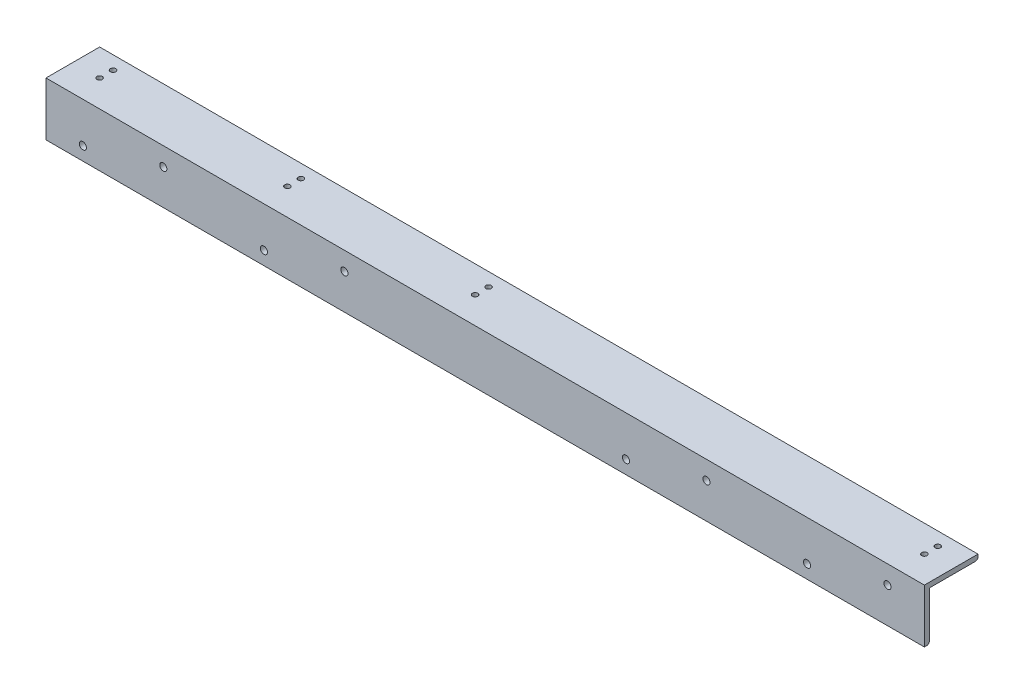
from build123d import *

# Parameters (mm, degrees)
BOSS_EXTRUDE1_DEPTH     = 415.925
F_1_4_CLEARANCE_HOLE1_D = 6.7564
LPATTERN1_COUNT         = 5
LPATTERN1_PITCH         = 171.45
F_10_CLEARANCE_HOLE2_D  = 5.1054


with BuildPart() as part:
    # Sketch1 → Boss-Extrude1 (new, symmetric)
    with BuildSketch(Plane(origin=(0, 0, 0), x_dir=(0, 0, -1), z_dir=(1, 0, 0))):
        with BuildLine():
            Line((0, 0), (50.8, 0))
            Line((50.8, 0), (50.8, -2.2225))
            ThreePointArc((50.8, -2.2225), (50.056051224, -4.018551224), (48.26, -4.7625))
            Line((48.26, -4.7625), (4.7625, -4.7625))
            Line((4.7625, -4.7625), (4.7625, -48.26))
            ThreePointArc((4.7625, -48.26), (4.018551224, -50.056051224), (2.2225, -50.8))
            Line((2.2225, -50.8), (0, -50.8))
            Line((0, -50.8), (0, 0))
        make_face()
    extrude(amount=BOSS_EXTRUDE1_DEPTH, both=True)

    # 1/4 Clearance Hole1 (through all)
    with Locations(Plane(origin=(0, 0, -4.7625), x_dir=(-1, 0, 0), z_dir=(0, 0, -1))):
        with Locations((-381, -17.4625), (-304.8, -38.1)):
            f_1_4_clearance_hole1 = Hole(F_1_4_CLEARANCE_HOLE1_D / 2)

    # LPattern1: 1/4 Clearance Hole1 ×5, 1 skipped
    with Locations(*[(-i * LPATTERN1_PITCH, 0, 0) for i in range(1, LPATTERN1_COUNT) if i not in (2,)]):
        add(f_1_4_clearance_hole1, mode=Mode.SUBTRACT)

    # #10 Clearance Hole2 (through all)
    with Locations(Plane(origin=(0, 0, 0), x_dir=(1, 0, 0), z_dir=(0, 1, 0))):
        with Locations((-34.925, 25.4), (-34.925, 38.1), (-212.725, 38.1), (-212.725, 25.4), (-390.525, 25.4), (-390.525, 38.1), (390.525, 38.1), (390.525, 25.4)):
            Hole(F_10_CLEARANCE_HOLE2_D / 2)


solid = part.part
